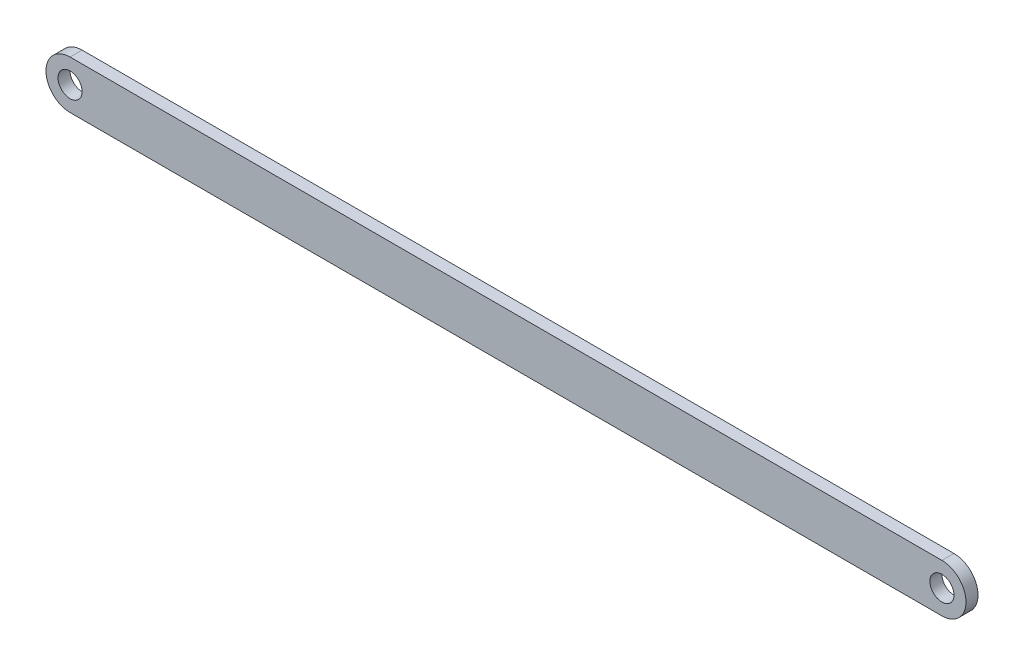
from build123d import *

# Parameters (mm, degrees)
SKETCH_1_R      = 4
EXTRUDE_1_DEPTH = 4


with BuildPart() as part:
    # 草图1 → 凸台-拉伸1 (new body)
    with BuildSketch(Plane.XY):
        with BuildLine():
            Line((-21.656050955, 7.617834395), (268.343949045, 7.617834395))
            ThreePointArc((268.343949045, 7.617834395), (276.343949045, -0.382165605), (268.343949045, -8.382165605))
            Line((268.343949045, -8.382165605), (-21.656050955, -8.382165605))
            ThreePointArc((-21.656050955, -8.382165605), (-29.656050955, -0.382165605), (-21.656050955, 7.617834395))
        make_face()
        with Locations((-21.656050955, -0.382165605)):
            Circle(SKETCH_1_R, mode=Mode.SUBTRACT)
        with Locations((268.343949045, -0.382165605)):
            Circle(SKETCH_1_R, mode=Mode.SUBTRACT)
    extrude(amount=EXTRUDE_1_DEPTH)


solid = part.part
